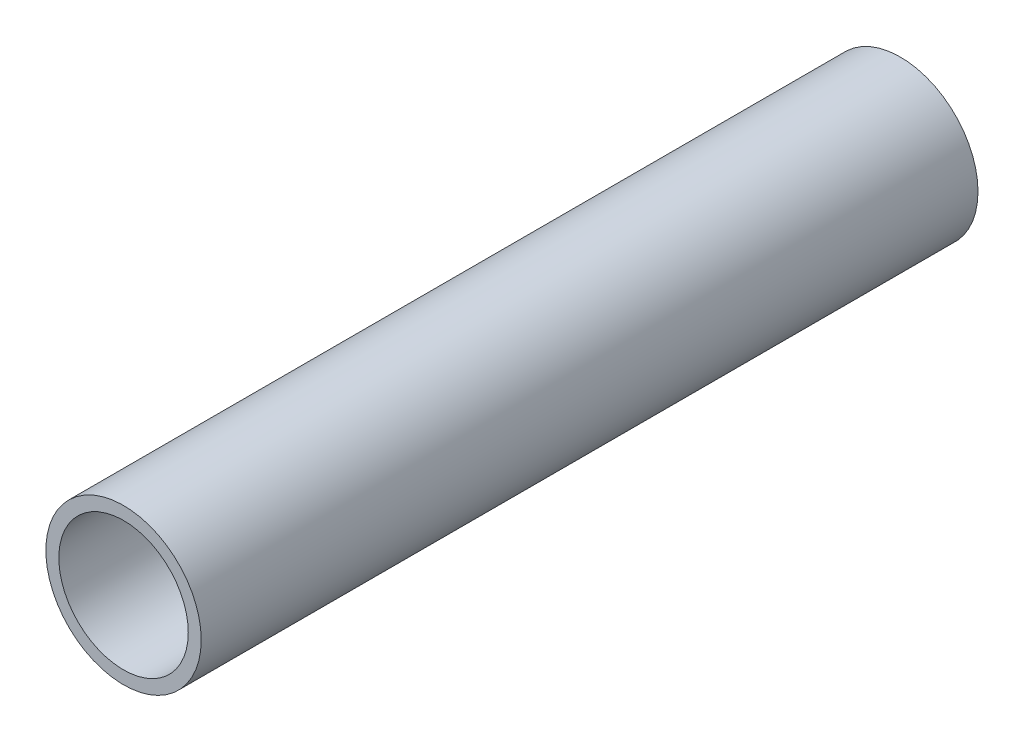
from build123d import *

# Parameters (mm, degrees)
SKETCH1_R           = 3
SKETCH1_R_2         = 2.5
BOSS_EXTRUDE1_DEPTH = 30


with BuildPart() as part:
    # Sketch1 → Boss-Extrude1 (new body)
    with BuildSketch(Plane.XY):
        Circle(SKETCH1_R)
        Circle(SKETCH1_R_2, mode=Mode.SUBTRACT)
    extrude(amount=BOSS_EXTRUDE1_DEPTH)


solid = part.part
